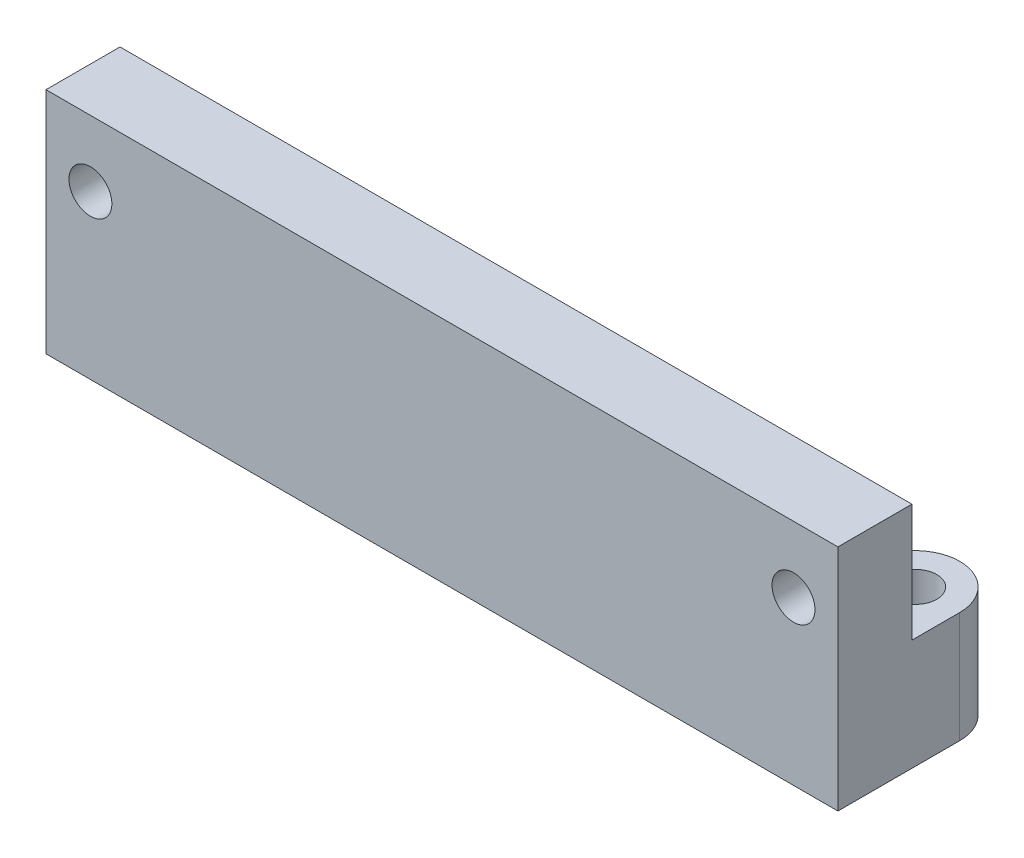
from build123d import *

# Parameters (mm, degrees)
BOSS_EXTRUDE1_DEPTH = 15
SKETCH5_W           = 107
SKETCH5_H           = 15.91087052
BOSS_EXTRUDE2_DEPTH = 10
CUT_EXTRUDE1_START  = -15
SKETCH6_R           = 2.9
CUT_EXTRUDE1_DEPTH  = 12.5
SKETCH7_R           = 2.9
CUT_EXTRUDE2_DEPTH  = 12.5


with BuildPart() as part:
    # Sketch4 → Boss-Extrude1 (new body)
    with BuildSketch(Plane(origin=(0, 0, 0), x_dir=(1, 0, 0), z_dir=(0, 1, 0))):
        with BuildLine():
            Line((13.184906132, 32.500351338), (-93.815093868, 32.500351338))
            Line((-93.815093868, 32.500351338), (-93.815093868, 48.957491145))
            ThreePointArc((-93.815093868, 48.957491145), (-87.815093868, 54.957491145), (-81.815093868, 48.957491145))
            ThreePointArc((-81.815093868, 48.957491145), (-40.315093868, 42.500341518), (1.184906132, 48.957491145))
            ThreePointArc((1.184906132, 48.957491145), (7.184906132, 54.957491145), (13.184906132, 48.957491145))
            Line((13.184906132, 48.957491145), (13.184906132, 32.500351338))
        make_face()
    extrude(amount=BOSS_EXTRUDE1_DEPTH)

    # Sketch5 → Boss-Extrude2 (add)
    with BuildSketch(Plane.XY.offset(-32.500351338)):
        with Locations((-40.315093868, 22.95543526)):
            Rectangle(SKETCH5_W, SKETCH5_H)
    extrude(amount=-BOSS_EXTRUDE2_DEPTH)

    # Sketch6 → Cut-Extrude1 (cut)
    with BuildSketch(Plane.XZ.offset(CUT_EXTRUDE1_START)):
        with Locations(Location((7.184906132, -48.957491145, 0), (0, 0, 90))):
            Circle(SKETCH6_R)
        with Locations(Location((-87.815093868, -48.957491145, 0), (0, 0, 90))):
            Circle(SKETCH6_R)
    extrude(amount=CUT_EXTRUDE1_DEPTH, mode=Mode.SUBTRACT)

    # Sketch7 → Cut-Extrude2 (cut)
    with BuildSketch(Plane(origin=(0, 0, -42.500351338), x_dir=(-1, 0, 0), z_dir=(0, 0, -1))):
        with Locations((-7.184906132, 22)):
            Circle(SKETCH7_R)
        with Locations((87.815093868, 22)):
            Circle(SKETCH7_R)
    extrude(amount=-CUT_EXTRUDE2_DEPTH, mode=Mode.SUBTRACT)


solid = part.part
